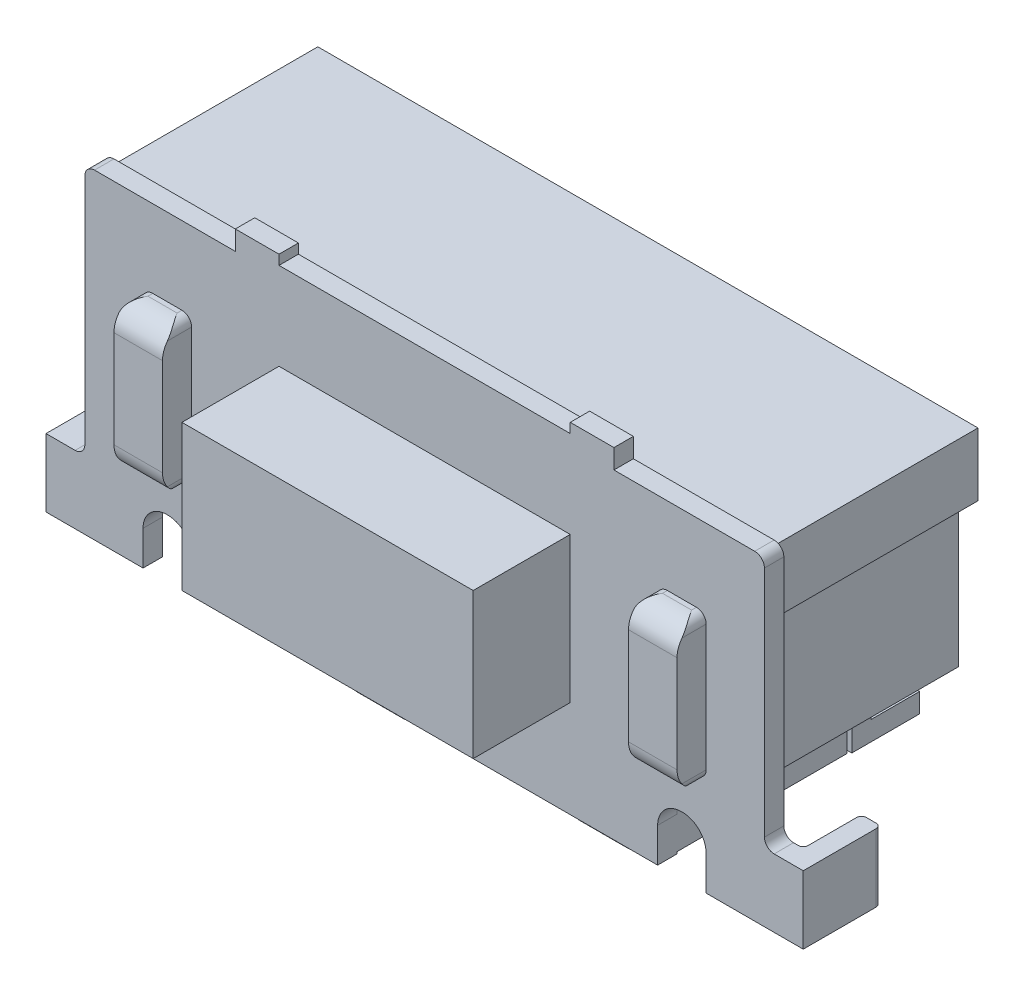
from build123d import *

# Parameters (mm, degrees)
CROQUIS2_W              = 7.8
CROQUIS2_H              = 3.5
SALIENTE_EXTRUIR1_DEPTH = 2.5
CROQUIS3_W              = 3
CROQUIS3_H              = 1.5
SALIENTE_EXTRUIR2_DEPTH = 1
CROQUIS4_R              = 0.4
SALIENTE_EXTRUIR3_DEPTH = 0.75
CROQUIS5_W              = 0.4
CROQUIS5_H              = 2.8
CORTAR_EXTRUIR1_DEPTH   = 2.5
SALIENTE_EXTRUIR4_DEPTH = 2.5
SALIENTE_EXTRUIR5_DEPTH = 2.5
SALIENTE_EXTRUIR6_DEPTH = 0.3
CORTAR_EXTRUIR2_DEPTH   = 2.5
CORTAR_EXTRUIR3_START   = -0.02
CROQUIS10_R             = 0.4
CORTAR_EXTRUIR3_DEPTH   = 0.02
CORTAR_EXTRUIR4_DEPTH   = 3.3
CROQUIS13_W             = 4.9
CROQUIS13_H             = 2.3
CROQUIS13_W_2           = 1.45
CROQUIS13_W_3           = 0.45
CORTAR_EXTRUIR5_DEPTH   = 0.25
CROQUIS17_W             = 0.6
CROQUIS17_H             = 0.7
SALIENTE_EXTRUIR7_DEPTH = 0.02
CROQUIS18_W             = 0.6
CROQUIS18_H             = 0.2
SALIENTE_EXTRUIR8_DEPTH = 0.8
CROQUIS19_W             = 0.6
CROQUIS19_H             = 0.62
CORTAR_EXTRUIR8_DEPTH   = 0.5
CROQUIS20_W             = 0.6
CROQUIS20_H             = 0.05
CORTAR_EXTRUIR9_DEPTH   = 0.8
CROQUIS21_W             = 0.6
CROQUIS21_H             = 2.3
CORTAR_EXTRUIR10_DEPTH  = 0.8
CROQUIS22_W             = 0.4
CROQUIS22_H             = 2.3
CORTAR_EXTRUIR11_DEPTH  = 2.58
CROQUIS23_W             = 3.6
CROQUIS23_H             = 0.55
CORTAR_EXTRUIR12_DEPTH  = 0.8
CROQUIS24_W             = 6.8
CROQUIS24_H             = 0.65
CORTAR_EXTRUIR13_DEPTH  = 0.2
CORTAR_EXTRUIR14_DEPTH  = 0.5
CORTAR_EXTRUIR15_START  = -0.5
CORTAR_EXTRUIR15_DEPTH  = 0.5
CORTAR_EXTRUIR16_DEPTH  = 0.5
CORTAR_EXTRUIR17_DEPTH  = 1.4
CORTAR_EXTRUIR18_DEPTH  = 1.65
CORTAR_EXTRUIR19_START  = -1.65
CORTAR_EXTRUIR19_DEPTH  = 1.65


with BuildPart() as part:
    # Croquis2 → Saliente-Extruir1 (new body)
    with BuildSketch(Plane.XY):
        with Locations((3.9, 1.75)):
            Rectangle(CROQUIS2_W, CROQUIS2_H)
    extrude(amount=SALIENTE_EXTRUIR1_DEPTH)

    # Croquis3 → Saliente-Extruir2 (add)
    with BuildSketch(Plane.XY.offset(2.5)):
        with Locations((3.9, 1.75)):
            Rectangle(CROQUIS3_W, CROQUIS3_H)
    extrude(amount=SALIENTE_EXTRUIR2_DEPTH)

    # Croquis4 → Saliente-Extruir3 (add)
    with BuildSketch(Plane.XZ):
        with Locations(Location((5.05, 1.5, 0), (0, 0, 90))):
            Circle(CROQUIS4_R)
        with Locations(Location((2.75, 1.5, 0), (0, 0, 90))):
            Circle(CROQUIS4_R)
    extrude(amount=SALIENTE_EXTRUIR3_DEPTH)

    # Croquis5 → Cortar-Extruir1 (cut)
    with BuildSketch(Plane.XY.offset(2.5)):
        with Locations((7.6, 2.1)):
            Rectangle(CROQUIS5_W, CROQUIS5_H)
        with Locations((0.2, 2.1)):
            Rectangle(CROQUIS5_W, CROQUIS5_H)
    extrude(amount=-CORTAR_EXTRUIR1_DEPTH, mode=Mode.SUBTRACT)

    # Croquis6 → Saliente-Extruir4 (add)
    with BuildSketch(Plane.XY.offset(2.5)):
        with BuildLine():
            ThreePointArc((0.4, 0.8), (0.370710678, 0.729289322), (0.3, 0.7))
            Line((0.3, 0.7), (0.4, 0.7))
            Line((0.4, 0.7), (0.4, 0.8))
        make_face()
    extrude(amount=-SALIENTE_EXTRUIR4_DEPTH)

    # Croquis7 → Saliente-Extruir5 (add)
    with BuildSketch(Plane.XY.offset(2.5)):
        with BuildLine():
            ThreePointArc((7.5, 0.7), (7.429289322, 0.729289322), (7.4, 0.8))
            Line((7.4, 0.8), (7.4, 0.7))
            Line((7.4, 0.7), (7.5, 0.7))
        make_face()
    extrude(amount=-SALIENTE_EXTRUIR5_DEPTH)

    # Croquis8 → Saliente-Extruir6 (add)
    with BuildSketch(Plane.XY.offset(2.5)):
        with BuildLine():
            Line((6.3, 1.1), (6.3, 2.4))
            ThreePointArc((6.3, 2.4), (6.329289322, 2.470710678), (6.4, 2.5))
            Line((6.4, 2.5), (6.7, 2.5))
            ThreePointArc((6.7, 2.5), (6.770710678, 2.470710678), (6.8, 2.4))
            Line((6.8, 2.4), (6.8, 1.1))
            ThreePointArc((6.8, 1.1), (6.770710678, 1.029289322), (6.7, 1))
            Line((6.7, 1), (6.4, 1))
            ThreePointArc((6.4, 1), (6.329289322, 1.029289322), (6.3, 1.1))
        make_face()
        with BuildLine():
            Line((1.5, 1.1), (1.5, 2.4))
            ThreePointArc((1.5, 2.4), (1.470710678, 2.470710678), (1.4, 2.5))
            Line((1.4, 2.5), (1.1, 2.5))
            ThreePointArc((1.1, 2.5), (1.029289322, 2.470710678), (1, 2.4))
            Line((1, 2.4), (1, 1.1))
            ThreePointArc((1, 1.1), (1.029289322, 1.029289322), (1.1, 1))
            Line((1.1, 1), (1.4, 1))
            ThreePointArc((1.4, 1), (1.470710678, 1.029289322), (1.5, 1.1))
        make_face()
    extrude(amount=SALIENTE_EXTRUIR6_DEPTH)

    # Croquis9 → Cortar-Extruir2 (cut)
    with BuildSketch(Plane.XY.offset(2.5)):
        with BuildLine():
            Line((1.95, 3.3), (1.95, 3.5))
            Line((1.95, 3.5), (0.4, 3.5))
            Line((0.4, 3.5), (0.4, 3.2))
            ThreePointArc((0.4, 3.2), (0.429289322, 3.270710678), (0.5, 3.3))
            Line((0.5, 3.3), (1.95, 3.3))
        make_face()
        Polygon((2.4, 3.4), (3.9, 3.4), (5.4, 3.4), (5.4, 3.5), (2.4, 3.5), align=None)
        with BuildLine():
            Line((7.4, 3.5), (5.85, 3.5))
            Line((5.85, 3.5), (5.85, 3.3))
            Line((5.85, 3.3), (7.3, 3.3))
            ThreePointArc((7.3, 3.3), (7.370710678, 3.270710678), (7.4, 3.2))
            Line((7.4, 3.2), (7.4, 3.5))
        make_face()
    extrude(amount=-CORTAR_EXTRUIR2_DEPTH, mode=Mode.SUBTRACT)

    # Croquis10 → Cortar-Extruir3 (cut)
    with BuildSketch(Plane.XZ.offset(CORTAR_EXTRUIR3_START)):
        with BuildLine():
            ThreePointArc((0.25, 2.3), (0.214644661, 2.285355339), (0.2, 2.25))
            Line((0.2, 2.25), (0.2, 1.75))
            ThreePointArc((0.2, 1.75), (0.185355339, 1.714644661), (0.15, 1.7))
            Line((0.15, 1.7), (0.05, 1.7))
            ThreePointArc((0.05, 1.7), (0.014644661, 1.714644661), (0, 1.75))
            Line((0, 1.75), (0, 0))
            Line((0, 0), (7.8, 0))
            Line((7.8, 0), (7.8, 1.75))
            ThreePointArc((7.8, 1.75), (7.785355339, 1.714644661), (7.75, 1.7))
            Line((7.75, 1.7), (7.65, 1.7))
            ThreePointArc((7.65, 1.7), (7.614644661, 1.714644661), (7.6, 1.75))
            Line((7.6, 1.75), (7.6, 2.25))
            ThreePointArc((7.6, 2.25), (7.585355339, 2.285355339), (7.55, 2.3))
            Line((7.55, 2.3), (0.25, 2.3))
        make_face()
        with Locations(Location((2.75, 1.5, 0), (0, 0, 270))):
            Circle(CROQUIS10_R, mode=Mode.SUBTRACT)
        with Locations(Location((5.05, 1.5, 0), (0, 0, 270))):
            Circle(CROQUIS10_R, mode=Mode.SUBTRACT)
    extrude(amount=CORTAR_EXTRUIR3_DEPTH, mode=Mode.SUBTRACT)

    # Croquis12 → Cortar-Extruir4 (cut)
    with BuildSketch(Plane(origin=(0, 3.3, 0), x_dir=(1, 0, 0), z_dir=(0, 1, 0))):
        with BuildLine():
            Line((7.3, 0), (7.3, -2.3))
            Line((7.3, -2.3), (7.55, -2.3))
            ThreePointArc((7.55, -2.3), (7.585355339, -2.285355339), (7.6, -2.25))
            Line((7.6, -2.25), (7.6, -1.75))
            ThreePointArc((7.6, -1.75), (7.614644661, -1.714644661), (7.65, -1.7))
            Line((7.65, -1.7), (7.75, -1.7))
            ThreePointArc((7.75, -1.7), (7.785355339, -1.714644661), (7.8, -1.75))
            Line((7.8, -1.75), (7.8, 0))
            Line((7.8, 0), (7.3, 0))
        make_face()
        with BuildLine():
            ThreePointArc((0.2, -1.75), (0.185355339, -1.714644661), (0.15, -1.7))
            Line((0.15, -1.7), (0.05, -1.7))
            ThreePointArc((0.05, -1.7), (0.014644661, -1.714644661), (0, -1.75))
            Line((0, -1.75), (0, 0))
            Line((0, 0), (0.5, 0))
            Line((0.5, 0), (0.5, -2.3))
            Line((0.5, -2.3), (0.25, -2.3))
            ThreePointArc((0.25, -2.3), (0.214644661, -2.285355339), (0.2, -2.25))
            Line((0.2, -2.25), (0.2, -1.75))
        make_face()
    extrude(amount=-CORTAR_EXTRUIR4_DEPTH, mode=Mode.SUBTRACT)

    # Croquis13 → Cortar-Extruir5 (cut)
    with BuildSketch(Plane(origin=(0, 3.5, 0), x_dir=(1, 0, 0), z_dir=(0, 1, 0))):
        with Locations((2.95, -1.15)):
            Rectangle(CROQUIS13_W, CROQUIS13_H)
        with Locations((6.575, -1.15)):
            Rectangle(CROQUIS13_W_2, CROQUIS13_H)
        with Locations((5.625, -1.15)):
            Rectangle(CROQUIS13_W_3, CROQUIS13_H)
    extrude(amount=-CORTAR_EXTRUIR5_DEPTH, mode=Mode.SUBTRACT)

    # Croquis17 → Saliente-Extruir7 (add)
    with BuildSketch(Plane.XZ.offset(-0.02)):
        with Locations((6, 0.15)):
            Rectangle(CROQUIS17_W, CROQUIS17_H)
        with Locations((1.8, 0.15)):
            Rectangle(CROQUIS17_W, CROQUIS17_H)
    extrude(amount=SALIENTE_EXTRUIR7_DEPTH)

    # Croquis18 → Saliente-Extruir8 (add)
    with BuildSketch(Plane(origin=(0, 0.02, 0), x_dir=(1, 0, 0), z_dir=(0, 1, 0))):
        with Locations((1.8, 0.1)):
            Rectangle(CROQUIS18_W, CROQUIS18_H)
        with Locations((6, 0.1)):
            Rectangle(CROQUIS18_W, CROQUIS18_H)
    extrude(amount=SALIENTE_EXTRUIR8_DEPTH)

    # Croquis19 → Cortar-Extruir8 (cut)
    with BuildSketch(Plane(origin=(0, 0, -0.2), x_dir=(-1, 0, 0), z_dir=(0, 0, -1))):
        with Locations((-6, 0.51)):
            Rectangle(CROQUIS19_W, CROQUIS19_H)
        with Locations((-1.8, 0.51)):
            Rectangle(CROQUIS19_W, CROQUIS19_H)
    extrude(amount=-CORTAR_EXTRUIR8_DEPTH, mode=Mode.SUBTRACT)

    # Croquis20 → Cortar-Extruir9 (cut)
    with BuildSketch(Plane.XZ):
        with Locations((1.8, 0.525)):
            Rectangle(CROQUIS20_W, CROQUIS20_H)
        with Locations((6, 0.525)):
            Rectangle(CROQUIS20_W, CROQUIS20_H)
    extrude(amount=-CORTAR_EXTRUIR9_DEPTH, mode=Mode.SUBTRACT)

    # Croquis21 → Cortar-Extruir10 (cut)
    with BuildSketch(Plane.XZ.offset(-0.02)):
        with Locations((1.2, 1.15)):
            Rectangle(CROQUIS21_W, CROQUIS21_H)
        with Locations((6.6, 1.15)):
            Rectangle(CROQUIS21_W, CROQUIS21_H)
    extrude(amount=-CORTAR_EXTRUIR10_DEPTH, mode=Mode.SUBTRACT)

    # Croquis22 → Cortar-Extruir11 (cut)
    with BuildSketch(Plane.XZ.offset(-0.02)):
        with Locations((0.7, 1.15)):
            Rectangle(CROQUIS22_W, CROQUIS22_H)
        with Locations((7.1, 1.15)):
            Rectangle(CROQUIS22_W, CROQUIS22_H)
    extrude(amount=-CORTAR_EXTRUIR11_DEPTH, mode=Mode.SUBTRACT)

    # Croquis23 → Cortar-Extruir12 (cut)
    with BuildSketch(Plane.XZ.offset(-0.02)):
        with Locations((3.9, 0.275)):
            Rectangle(CROQUIS23_W, CROQUIS23_H)
    extrude(amount=-CORTAR_EXTRUIR12_DEPTH, mode=Mode.SUBTRACT)

    # Croquis24 → Cortar-Extruir13 (cut)
    with BuildSketch(Plane(origin=(0, 0, 0), x_dir=(-1, 0, 0), z_dir=(0, 0, -1))):
        with Locations((-3.9, 2.925)):
            Rectangle(CROQUIS24_W, CROQUIS24_H)
    extrude(amount=-CORTAR_EXTRUIR13_DEPTH, mode=Mode.SUBTRACT)

    # Croquis25 → Cortar-Extruir14 (cut)
    with BuildSketch(Plane(origin=(6.8, 0, 0), x_dir=(0, 0, -1), z_dir=(1, 0, 0))):
        with BuildLine():
            Line((-2.8, 2.4), (-2.75, 2.4))
            ThreePointArc((-2.75, 2.4), (-2.661803399, 2.473606798), (-2.55, 2.5))
            Line((-2.55, 2.5), (-2.8, 2.5))
            Line((-2.8, 2.5), (-2.8, 2.4))
        make_face()
        with BuildLine():
            ThreePointArc((-2.8, 2.25), (-2.787170825, 2.329056942), (-2.75, 2.4))
            Line((-2.75, 2.4), (-2.8, 2.4))
            Line((-2.8, 2.4), (-2.8, 2.25))
        make_face()
        with BuildLine():
            Line((-2.8, 1), (-2.55, 1))
            ThreePointArc((-2.55, 1), (-2.661803399, 1.026393202), (-2.75, 1.1))
            Line((-2.75, 1.1), (-2.8, 1.1))
            Line((-2.8, 1.1), (-2.8, 1))
        make_face()
        with BuildLine():
            Line((-2.8, 1.1), (-2.75, 1.1))
            ThreePointArc((-2.75, 1.1), (-2.787170825, 1.170943058), (-2.8, 1.25))
            Line((-2.8, 1.25), (-2.8, 1.1))
        make_face()
    extrude(amount=-CORTAR_EXTRUIR14_DEPTH, mode=Mode.SUBTRACT)

    # Croquis26 → Cortar-Extruir15 (cut)
    with BuildSketch(Plane.ZY.offset(-1).offset(CORTAR_EXTRUIR15_START)):
        with BuildLine():
            Line((2.8, 2.5), (2.55, 2.5))
            ThreePointArc((2.55, 2.5), (2.661803399, 2.473606798), (2.75, 2.4))
            Line((2.75, 2.4), (2.8, 2.4))
            Line((2.8, 2.4), (2.8, 2.5))
        make_face()
        with BuildLine():
            Line((2.8, 2.4), (2.75, 2.4))
            ThreePointArc((2.75, 2.4), (2.787170825, 2.329056942), (2.8, 2.25))
            Line((2.8, 2.25), (2.8, 2.4))
        make_face()
        with BuildLine():
            Line((2.8, 1.1), (2.75, 1.1))
            ThreePointArc((2.75, 1.1), (2.661803399, 1.026393202), (2.55, 1))
            Line((2.55, 1), (2.8, 1))
            Line((2.8, 1), (2.8, 1.1))
        make_face()
        with BuildLine():
            ThreePointArc((2.8, 1.25), (2.787170825, 1.170943058), (2.75, 1.1))
            Line((2.75, 1.1), (2.8, 1.1))
            Line((2.8, 1.1), (2.8, 1.25))
        make_face()
    extrude(amount=CORTAR_EXTRUIR15_DEPTH, mode=Mode.SUBTRACT)

    # Croquis28 → Cortar-Extruir16 (cut)
    with BuildSketch(Plane.XY.offset(2.5)):
        with BuildLine():
            Line((1, 0), (1.5, 0))
            Line((1.5, 0), (1.5, 0.355))
            ThreePointArc((1.5, 0.355), (1.428241161, 0.528241161), (1.255, 0.6))
            Line((1.255, 0.6), (1.245, 0.6))
            ThreePointArc((1.245, 0.6), (1.071758839, 0.528241161), (1, 0.355))
            Line((1, 0.355), (1, 0))
        make_face()
        with BuildLine():
            Line((6.3, 0), (6.8, 0))
            Line((6.8, 0), (6.8, 0.355))
            ThreePointArc((6.8, 0.355), (6.728241161, 0.528241161), (6.555, 0.6))
            Line((6.555, 0.6), (6.545, 0.6))
            ThreePointArc((6.545, 0.6), (6.371758839, 0.528241161), (6.3, 0.355))
            Line((6.3, 0.355), (6.3, 0))
        make_face()
    extrude(amount=-CORTAR_EXTRUIR16_DEPTH, mode=Mode.SUBTRACT)

    # Croquis29 → Cortar-Extruir17 (cut)
    with BuildSketch(Plane.XY.offset(2.5)):
        with BuildLine():
            Line((2.35, -0.75), (2.6, -0.75))
            ThreePointArc((2.6, -0.75), (2.423223305, -0.676776695), (2.35, -0.5))
            Line((2.35, -0.5), (2.35, -0.75))
        make_face()
        with BuildLine():
            ThreePointArc((2.9, -0.75), (3.076776695, -0.676776695), (3.15, -0.5))
            Line((3.15, -0.5), (3.15, -0.75))
            Line((3.15, -0.75), (2.9, -0.75))
        make_face()
        with BuildLine():
            Line((4.9, -0.75), (4.65, -0.75))
            Line((4.65, -0.75), (4.65, -0.5))
            ThreePointArc((4.65, -0.5), (4.723223305, -0.676776695), (4.9, -0.75))
        make_face()
        with BuildLine():
            ThreePointArc((5.2, -0.75), (5.376776695, -0.676776695), (5.45, -0.5))
            Line((5.45, -0.5), (5.45, -0.75))
            Line((5.45, -0.75), (5.2, -0.75))
        make_face()
    extrude(amount=-CORTAR_EXTRUIR17_DEPTH, mode=Mode.SUBTRACT)

    # Croquis30 → Cortar-Extruir18 (cut)
    with BuildSketch(Plane.ZY.offset(-1.5)):
        with BuildLine():
            Line((1.1, -0.75), (1.35, -0.75))
            ThreePointArc((1.35, -0.75), (1.173223305, -0.676776695), (1.1, -0.5))
            Line((1.1, -0.5), (1.1, -0.75))
        make_face()
        with BuildLine():
            Line((1.9, -0.5), (1.9, -0.75))
            Line((1.9, -0.75), (1.65, -0.75))
            ThreePointArc((1.65, -0.75), (1.826776695, -0.676776695), (1.9, -0.5))
        make_face()
    extrude(amount=-CORTAR_EXTRUIR18_DEPTH, mode=Mode.SUBTRACT)

    # Croquis31 → Cortar-Extruir19 (cut)
    with BuildSketch(Plane(origin=(6.3, 0, 0), x_dir=(0, 0, -1), z_dir=(1, 0, 0)).offset(CORTAR_EXTRUIR19_START)):
        with BuildLine():
            Line((-1.9, -0.75), (-1.65, -0.75))
            ThreePointArc((-1.65, -0.75), (-1.826776695, -0.676776695), (-1.9, -0.5))
            Line((-1.9, -0.5), (-1.9, -0.75))
        make_face()
        with BuildLine():
            Line((-1.1, -0.75), (-1.1, -0.5))
            ThreePointArc((-1.1, -0.5), (-1.173223305, -0.676776695), (-1.35, -0.75))
            Line((-1.35, -0.75), (-1.1, -0.75))
        make_face()
    extrude(amount=CORTAR_EXTRUIR19_DEPTH, mode=Mode.SUBTRACT)


solid = part.part
